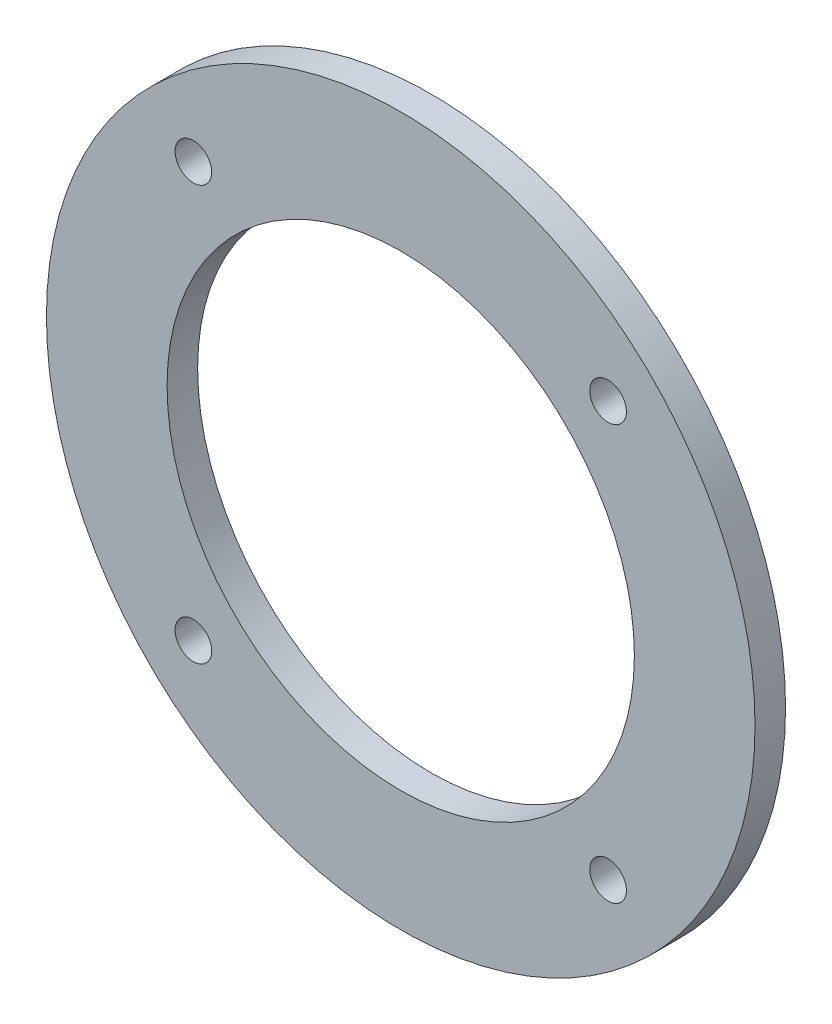
from build123d import *

# Parameters (mm, degrees)
ESQUISSE1_R        = 58
ESQUISSE1_R_2      = 38.25
ESQUISSE1_R_3      = 3
BOSS_EXTRU_1_DEPTH = 5


with BuildPart() as part:
    # Esquisse1 → Boss.-Extru.1 (new body)
    with BuildSketch(Plane.XY):
        Circle(ESQUISSE1_R)
        Circle(ESQUISSE1_R_2, mode=Mode.SUBTRACT)
        with Locations((33.941125497, 33.941125497)):
            Circle(ESQUISSE1_R_3, mode=Mode.SUBTRACT)
        with Locations((33.941125497, -33.941125497)):
            Circle(ESQUISSE1_R_3, mode=Mode.SUBTRACT)
        with Locations((-33.941125497, -33.941125497)):
            Circle(ESQUISSE1_R_3, mode=Mode.SUBTRACT)
        with Locations((-33.941125497, 33.941125497)):
            Circle(ESQUISSE1_R_3, mode=Mode.SUBTRACT)
    extrude(amount=BOSS_EXTRU_1_DEPTH)


solid = part.part
